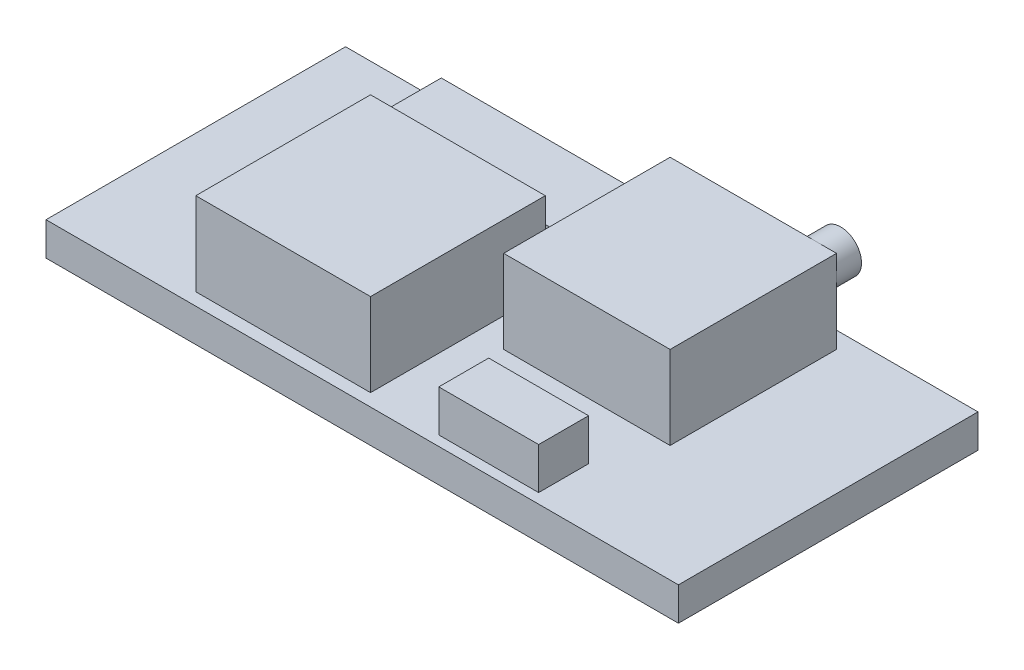
from build123d import *

# Parameters (mm, degrees)
SKETCH1_W           = 38
SKETCH1_H           = 18
BOSS_EXTRUDE1_DEPTH = 2
SKETCH2_W           = 6
SKETCH2_H           = 3
SKETCH2_W_2         = 11
SKETCH2_H_2         = 4.5
BOSS_EXTRUDE2_DEPTH = 2.5
SKETCH3_W           = 10.5
SKETCH3_H           = 10.5
SKETCH3_W_2         = 10
SKETCH3_H_2         = 10
BOSS_EXTRUDE3_DEPTH = 5
SKETCH4_R           = 1.25
BOSS_EXTRUDE4_DEPTH = 1.5


with BuildPart() as part:
    # Sketch1 → Boss-Extrude1 (new body)
    with BuildSketch(Plane(origin=(0, 0, 0), x_dir=(1, 0, 0), z_dir=(0, 1, 0))):
        Rectangle(SKETCH1_W, SKETCH1_H)
    extrude(amount=BOSS_EXTRUDE1_DEPTH)

    # Sketch2 → Boss-Extrude2 (add)
    with BuildSketch(Plane(origin=(0, 2, 0), x_dir=(1, 0, 0), z_dir=(0, 1, 0))):
        with Locations((7, -6.9)):
            Rectangle(SKETCH2_W, SKETCH2_H)
        with Locations((-6.5, 5.5)):
            Rectangle(SKETCH2_W_2, SKETCH2_H_2)
    extrude(amount=BOSS_EXTRUDE2_DEPTH)

    # Sketch3 → Boss-Extrude3 (add)
    with BuildSketch(Plane(origin=(0, 2, 0), x_dir=(1, 0, 0), z_dir=(0, 1, 0))):
        with Locations((-5.5, -3)):
            Rectangle(SKETCH3_W, SKETCH3_H)
        with Locations((6.5, 3)):
            Rectangle(SKETCH3_W_2, SKETCH3_H_2)
    extrude(amount=BOSS_EXTRUDE3_DEPTH)

    # Sketch4 → Boss-Extrude4 (add)
    with BuildSketch(Plane(origin=(0, 0, -8), x_dir=(-1, 0, 0), z_dir=(0, 0, -1))):
        with Locations(Location((-10.25, 5.75, 0), (0, 0, 180))):
            Circle(SKETCH4_R)
    extrude(amount=BOSS_EXTRUDE4_DEPTH)


solid = part.part
